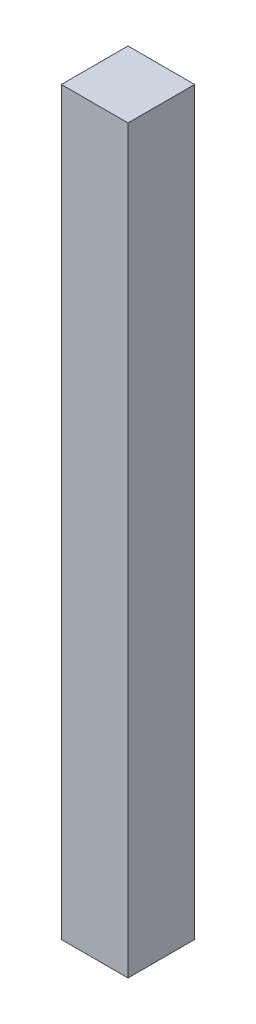
from build123d import *

# Parameters (mm, degrees)
STORE_KLAPE_KASET_KATI_GAZLI_AMORTISOR_1_START = -12
SKETCH1_W                                      = 18
SKETCH1_H                                      = 200
STORE_KLAPE_KASET_KATI_GAZLI_AMORTISOR_1_DEPTH = 18


with BuildPart() as part:
    # Sketch1 → STORE_klape_kaset_kati_gazli_amortisor_1_1 (new body)
    with BuildSketch(Plane.XY.offset(STORE_KLAPE_KASET_KATI_GAZLI_AMORTISOR_1_START)):
        with Locations((93, 536)):
            Rectangle(SKETCH1_W, SKETCH1_H)
    extrude(amount=-STORE_KLAPE_KASET_KATI_GAZLI_AMORTISOR_1_DEPTH)


solid = part.part
